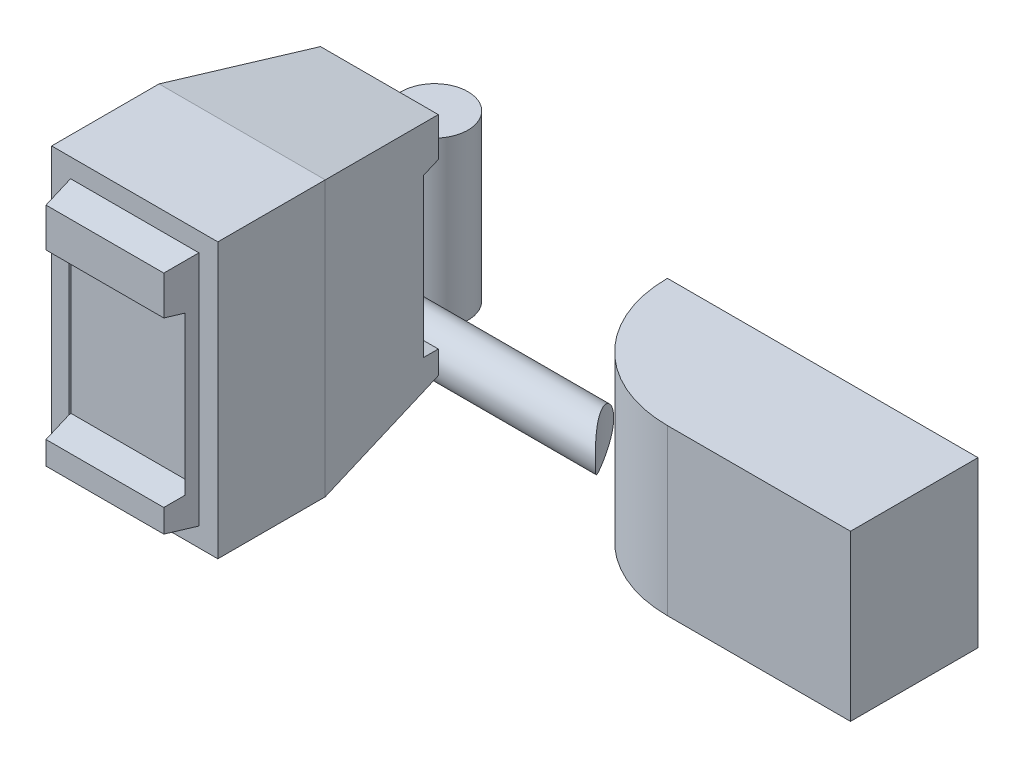
from build123d import *

# Parameters (mm, degrees)
CUBE_DEPTH                      = 40
CUBE_DEPTH_BACK                 = 80
BOSS_EXTRUDE2_REACH             = 186.47
SKETCH2_R                       = 24.297750185
SKETCH2_W                       = 48.59550037
SKETCH2_H                       = 45.426228606
BOSS_EXTRUDE2_DIRECTION_2_REACH = 186.47
BOSS_EXTRUDE3_REACH             = 412.881
BOSS_EXTRUDE3_END_RADIUS        = 102.894702313
SKETCH3_R                       = 17.52720412
SKETCH4_W                       = 121.092692674
SKETCH4_H                       = 78.257623931
BOSS_EXTRUDE4_DEPTH             = 200
SKETCH5_W                       = 121.092692674
SKETCH5_H                       = 200
SKETCH5_W_2                     = 62.357770304
SKETCH5_H_2                     = 84.288111015
BOSS_EXTRUDE5_DEPTH             = 100
BOSS_EXTRUDE5_TAPER             = 10
BOSS_EXTRUDE5_OTHER_WAY_DEPTH   = 100
BOSS_EXTRUDE5_OTHER_WAY_TAPER   = 10


with BuildPart() as part:
    # Rectangle for cube → cube (new, two sides: drawn at the far end of the back side and taken through both)
    with BuildSketch(Plane(origin=(0, 0, 0), x_dir=(1, 0, 0), z_dir=(0, 1, 0)).offset(-CUBE_DEPTH_BACK)):
        with BuildLine():
            Line((-159.598827762, 46.447351156), (-66.704125449, 46.447351156))
            Line((-66.704125449, 46.447351156), (66.704125449, 46.447351156))
            Line((66.704125449, 46.447351156), (66.704125449, -46.447351156))
            Line((66.704125449, -46.447351156), (-66.704125449, -46.447351156))
            ThreePointArc((-66.704125449, -46.447351156), (-132.390599391, -19.239122785), (-159.598827762, 46.447351156))
        make_face()
    extrude(amount=CUBE_DEPTH + CUBE_DEPTH_BACK)


with BuildPart() as body_2:

    # Boss-Extrude2: up to this face of the body (flat: up to its plane)
    boss_extrude2_end = Plane(part.part.faces().sort_by_distance((-37.521220462, 40, -2.482426343))[0])
    # Sketch2 → Boss-Extrude2 (new, up to the picked face)
    with BuildSketch(Plane(origin=(0, 0, 0), x_dir=(1, 0, 0), z_dir=(0, 1, 0)), mode=Mode.PRIVATE) as boss_extrude2_sk1:
        with Locations(Location((-350.067722674, 67.285453273, 0), (0, 0, 90))):
            Circle(SKETCH2_R)
    boss_extrude2_tool1 = split(extrude(boss_extrude2_sk1.sketch, amount=BOSS_EXTRUDE2_REACH, mode=Mode.PRIVATE), bisect_by=boss_extrude2_end, keep=Keep.BOTH, mode=Mode.PRIVATE)
    # Sketch2 → Boss-Extrude2 (new, up to the picked face)
    with BuildSketch(Plane(origin=(0, 0, 0), x_dir=(1, 0, 0), z_dir=(0, 1, 0)), mode=Mode.PRIVATE) as boss_extrude2_sk2:
        with Locations((-350.067722674, -5.607797281)):
            Rectangle(SKETCH2_W, SKETCH2_H)
    boss_extrude2_tool2 = split(extrude(boss_extrude2_sk2.sketch, amount=BOSS_EXTRUDE2_REACH, mode=Mode.PRIVATE), bisect_by=boss_extrude2_end, keep=Keep.BOTH, mode=Mode.PRIVATE)
    add(boss_extrude2_tool1.solids().sort_by(Axis((-350.067723, 0, -67.285453), (0, 1, 0)))[0])
    add(boss_extrude2_tool2.solids().sort_by(Axis((-350.067723, 0, 5.607797), (0, 1, 0)))[0])


    # Boss-Extrude2 direction 2: up to this face of the body (flat: up to its plane)
    boss_extrude2_direction_2_end = Plane(part.part.faces().sort_by_distance((-37.521220462, -80, -2.482426343))[0])
    # Sketch2 → Boss-Extrude2 direction 2 (add, up to the picked face)
    with BuildSketch(Plane(origin=(0, 0, 0), x_dir=(1, 0, 0), z_dir=(0, 1, 0)), mode=Mode.PRIVATE) as boss_extrude2_direction_2_sk1:
        with Locations(Location((-350.067722674, 67.285453273, 0), (0, 0, 90))):
            Circle(SKETCH2_R)
    boss_extrude2_direction_2_tool1 = split(extrude(boss_extrude2_direction_2_sk1.sketch, amount=-BOSS_EXTRUDE2_DIRECTION_2_REACH, mode=Mode.PRIVATE), bisect_by=boss_extrude2_direction_2_end, keep=Keep.BOTH, mode=Mode.PRIVATE)
    # Sketch2 → Boss-Extrude2 direction 2 (add, up to the picked face)
    with BuildSketch(Plane(origin=(0, 0, 0), x_dir=(1, 0, 0), z_dir=(0, 1, 0)), mode=Mode.PRIVATE) as boss_extrude2_direction_2_sk2:
        with Locations((-350.067722674, -5.607797281)):
            Rectangle(SKETCH2_W, SKETCH2_H)
    boss_extrude2_direction_2_tool2 = split(extrude(boss_extrude2_direction_2_sk2.sketch, amount=-BOSS_EXTRUDE2_DIRECTION_2_REACH, mode=Mode.PRIVATE), bisect_by=boss_extrude2_direction_2_end, keep=Keep.BOTH, mode=Mode.PRIVATE)
    add(boss_extrude2_direction_2_tool1.solids().sort_by(Axis((-350.067723, 0, -67.285453), (0, -1, 0)))[0])
    add(boss_extrude2_direction_2_tool2.solids().sort_by(Axis((-350.067723, 0, 5.607797), (0, -1, 0)))[0])

    # Boss-Extrude3: up to this cylinder (the profile starts outside it)
    boss_extrude3_end = Plane(origin=(-66.704125449, -32.181078, -46.447351156), z_dir=(0, 1, 0)) * Cylinder(BOSS_EXTRUDE3_END_RADIUS, 1032.551404626, mode=Mode.PRIVATE)
    # Sketch3 → Boss-Extrude3 (add, up to the surface)
    with BuildSketch(Plane(origin=(-325.769972489, 0, 0), x_dir=(0, 0, -1), z_dir=(1, 0, 0)), mode=Mode.PRIVATE) as boss_extrude3_sk1:
        with Locations(Location((-6.492795735, -32.18107782, 0), (0, 0, 180))):
            Circle(SKETCH3_R)
    boss_extrude3_tool1 = extrude(boss_extrude3_sk1.sketch, amount=BOSS_EXTRUDE3_REACH, mode=Mode.PRIVATE) - boss_extrude3_end
    add(boss_extrude3_tool1.solids().sort_by_distance((-325.769972, -32.181078, 6.492796))[0])


with BuildPart() as body_3:
    # Sketch4 → Boss-Extrude4 (new body)
    with BuildSketch(Plane(origin=(0, 0, 0), x_dir=(1, 0, 0), z_dir=(0, 1, 0))):
        with Locations((-246.915772104, -215.203987641)):
            Rectangle(SKETCH4_W, SKETCH4_H)
    extrude(amount=BOSS_EXTRUDE4_DEPTH)

    # Sketch5 → Boss-Extrude5 (add)
    with BuildSketch(Plane(origin=(0, 0, 176.075175675), x_dir=(-1, 0, 0), z_dir=(0, 0, -1))):
        with Locations((246.915772104, 100)):
            Rectangle(SKETCH5_W, SKETCH5_H)
        with Locations((248.236273577, 94.236257506)):
            Rectangle(SKETCH5_W_2, SKETCH5_H_2, mode=Mode.SUBTRACT)
    extrude(amount=BOSS_EXTRUDE5_DEPTH, taper=BOSS_EXTRUDE5_TAPER)

    # Sketch5 → Boss-Extrude5 other way (add)
    with BuildSketch(Plane(origin=(0, 0, 176.075175675), x_dir=(-1, 0, 0), z_dir=(0, 0, -1))):
        with Locations((246.915772104, 100)):
            Rectangle(SKETCH5_W, SKETCH5_H)
        with Locations((248.236273577, 94.236257506)):
            Rectangle(SKETCH5_W_2, SKETCH5_H_2, mode=Mode.SUBTRACT)
    extrude(amount=-BOSS_EXTRUDE5_OTHER_WAY_DEPTH, taper=BOSS_EXTRUDE5_OTHER_WAY_TAPER)


solid = Compound([part.part, body_2.part, body_3.part])
